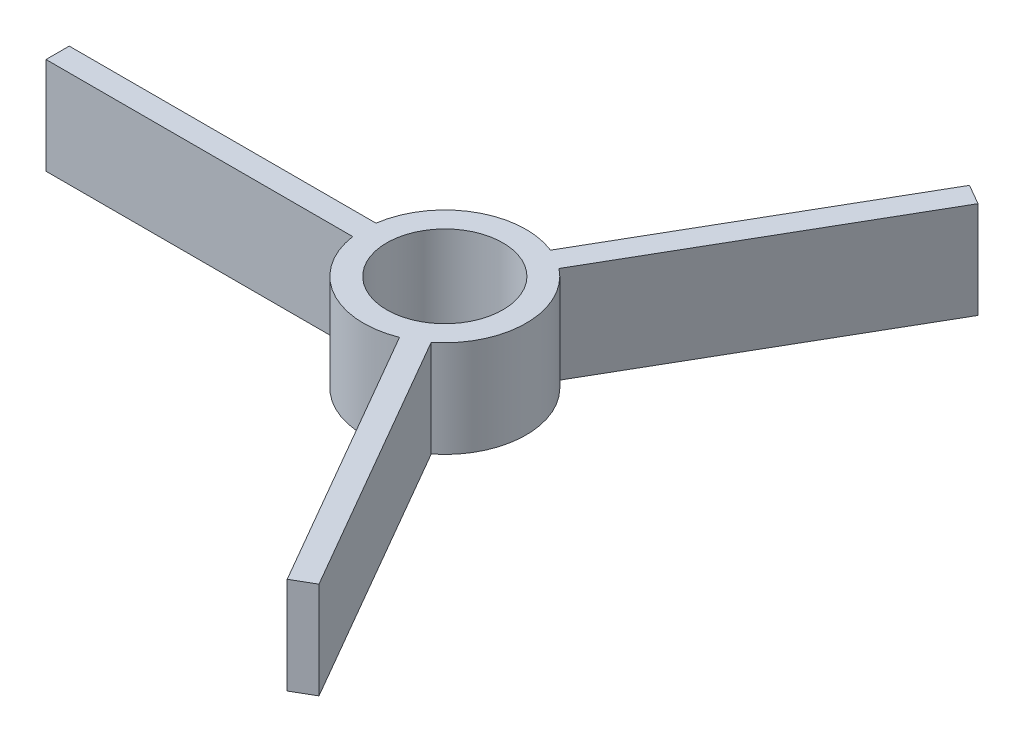
from build123d import *

# Parameters (mm, degrees)
SKETCH1_R           = 3
BOSS_EXTRUDE2_DEPTH = 5


with BuildPart() as part:
    # Sketch1 → Boss-Extrude2 (new body)
    with BuildSketch(Plane(origin=(0, 0, 0), x_dir=(1, 0, 0), z_dir=(0, 1, 0))):
        with BuildLine():
            Line((-4.156921938, -0.6), (-20, -0.6))
            Line((-20, -0.6), (-20, 0.6))
            Line((-20, 0.6), (-4.156921938, 0.6))
            ThreePointArc((-4.156921938, 0.6), (-2.1, 3.637306696), (1.558845727, 3.9))
            Line((1.558845727, 3.9), (9.480384758, 17.620508076))
            Line((9.480384758, 17.620508076), (10.519615242, 17.020508076))
            Line((10.519615242, 17.020508076), (2.598076211, 3.3))
            ThreePointArc((2.598076211, 3.3), (4.2, 0), (2.598076211, -3.3))
            Line((2.598076211, -3.3), (10.519615242, -17.020508076))
            Line((10.519615242, -17.020508076), (9.480384758, -17.620508076))
            Line((9.480384758, -17.620508076), (1.558845727, -3.9))
            ThreePointArc((1.558845727, -3.9), (-2.1, -3.637306696), (-4.156921938, -0.6))
        make_face()
        with Locations(Location((0, 0, 0), (0, 0, 270))):
            Circle(SKETCH1_R, mode=Mode.SUBTRACT)
    extrude(amount=BOSS_EXTRUDE2_DEPTH)


solid = part.part
